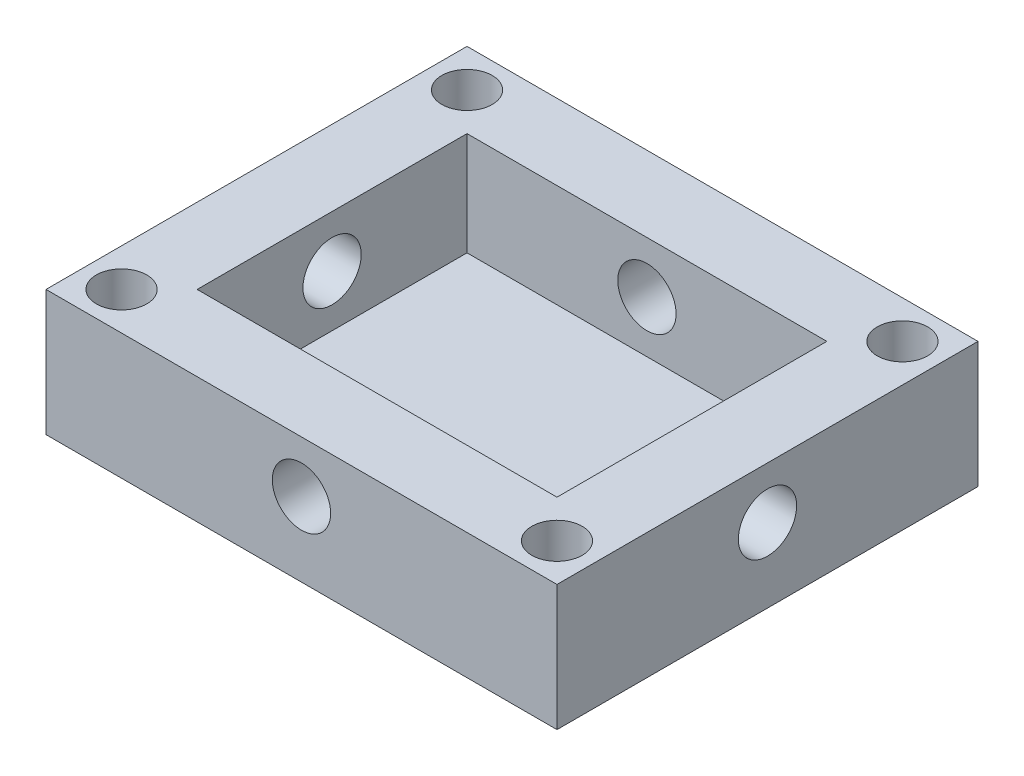
from build123d import *

# Parameters (mm, degrees)
SKETCH1_W               = 36.068
SKETCH1_H               = 29.718
SKETCH1_W_2             = 25.4
SKETCH1_H_2             = 19.05
BOSS_EXTRUDE3_DEPTH     = 7.2898
SKETCH4_W               = 36.068
SKETCH4_H               = 29.718
BOSS_EXTRUDE4_DEPTH     = 1.5875
SKETCH5_R               = 1.778
CUT_EXTRUDE2_DEPTH      = 9.525
CUT_EXTRUDE3_DEPTH      = 40.684149091
CUT_EXTRUDE3_DEPTH_BACK = 40.684149091
SKETCH6_R               = 2.0574
SKETCH7_R               = 2.0574
CUT_EXTRUDE4_DEPTH      = 36.51796537


with BuildPart() as part:
    # Sketch1 → Boss-Extrude3 (new body)
    with BuildSketch(Plane(origin=(0, 0, 0), x_dir=(1, 0, 0), z_dir=(0, 1, 0))):
        Rectangle(SKETCH1_W, SKETCH1_H)
        Rectangle(SKETCH1_W_2, SKETCH1_H_2, mode=Mode.SUBTRACT)
    extrude(amount=BOSS_EXTRUDE3_DEPTH)

    # Sketch4 → Boss-Extrude4 (add)
    with BuildSketch(Plane.XZ):
        Rectangle(SKETCH4_W, SKETCH4_H)
    extrude(amount=BOSS_EXTRUDE4_DEPTH)

    # Sketch5 → Cut-Extrude2 (cut)
    with BuildSketch(Plane(origin=(0, 7.2898, 0), x_dir=(1, 0, 0), z_dir=(0, 1, 0))):
        with Locations(Location((-15.367, 12.192, 0), (0, 0, 270))):
            Circle(SKETCH5_R)
        with Locations(Location((15.367, 12.192, 0), (0, 0, 270))):
            Circle(SKETCH5_R)
        with Locations(Location((15.367, -12.192, 0), (0, 0, 270))):
            Circle(SKETCH5_R)
        with Locations(Location((-15.367, -12.192, 0), (0, 0, 270))):
            Circle(SKETCH5_R)
    extrude(amount=-CUT_EXTRUDE2_DEPTH, mode=Mode.SUBTRACT)

    # Sketch6 → Cut-Extrude3 (cut, two sides: drawn at the far end of the back side and taken through both)
    with BuildSketch(Plane(origin=(18.034, 0, 0), x_dir=(0, 0, -1), z_dir=(1, 0, 0)).offset(-CUT_EXTRUDE3_DEPTH_BACK)):
        with Locations((0, 3.6449)):
            Circle(SKETCH6_R)
    extrude(amount=CUT_EXTRUDE3_DEPTH + CUT_EXTRUDE3_DEPTH_BACK, mode=Mode.SUBTRACT)

    # Sketch7 → Cut-Extrude4 (cut, through all)
    with BuildSketch(Plane.XY.offset(14.859)):
        with Locations((0, 3.6449)):
            Circle(SKETCH7_R)
    extrude(amount=-CUT_EXTRUDE4_DEPTH, mode=Mode.SUBTRACT)


solid = part.part
